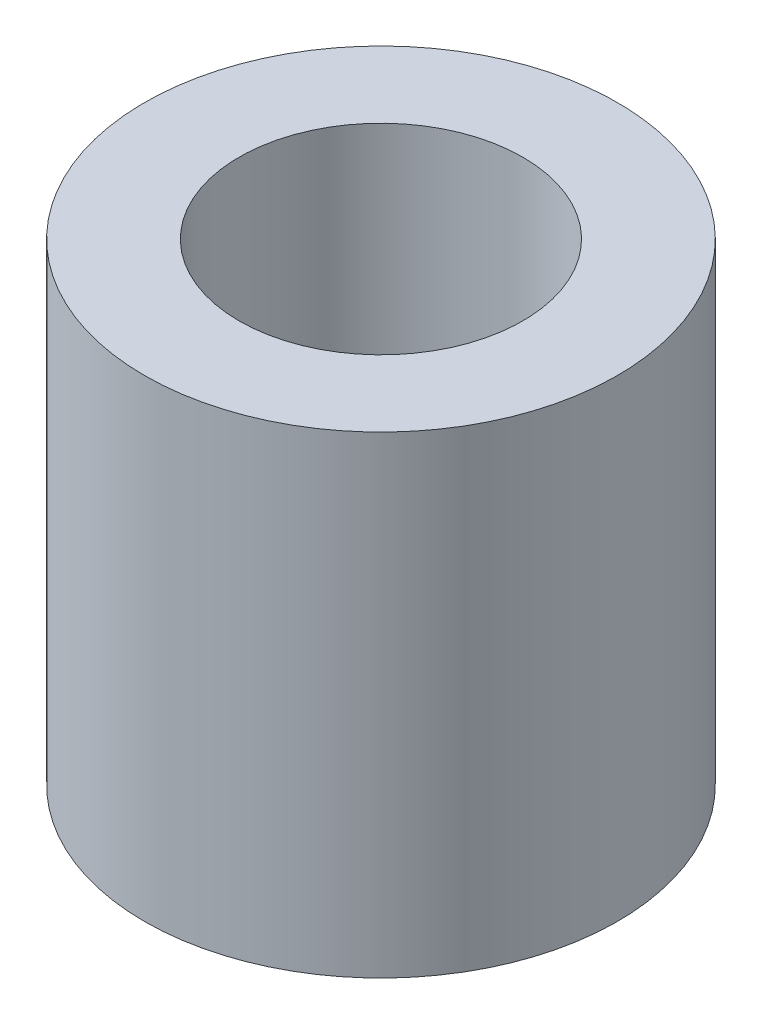
from build123d import *

# Parameters (mm, degrees)
SKETCH1_R           = 2.5
SKETCH1_R_2         = 1.5
BOSS_EXTRUDE1_DEPTH = 5


with BuildPart() as part:
    # Sketch1 → Boss-Extrude1 (new body)
    with BuildSketch(Plane(origin=(0, 0, 0), x_dir=(1, 0, 0), z_dir=(0, 1, 0))):
        with Locations(Location((0, 0, 0), (0, 0, 270))):
            Circle(SKETCH1_R)
        with Locations(Location((0, 0, 0), (0, 0, 270))):
            Circle(SKETCH1_R_2, mode=Mode.SUBTRACT)
    extrude(amount=BOSS_EXTRUDE1_DEPTH)


solid = part.part
